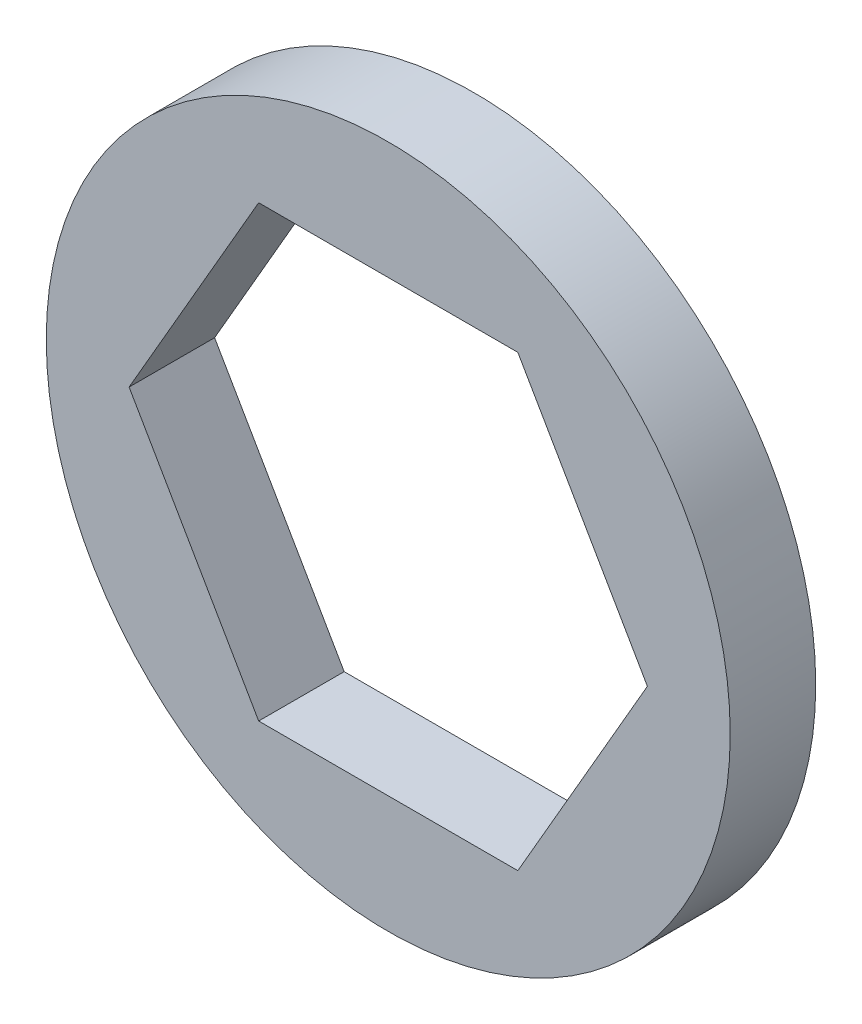
from build123d import *

# Parameters (mm, degrees)
SKETCH1_R           = 4
BOSS_EXTRUDE1_DEPTH = 1


with BuildPart() as part:
    # Sketch1 → Boss-Extrude1 (new body)
    with BuildSketch(Plane.XY):
        Circle(SKETCH1_R)
        Polygon((3.031088913, 0), (1.515544457, 2.625), (-1.515544457, 2.625), (-3.031088913, 0), (-1.515544457, -2.625), (1.515544457, -2.625), align=None, mode=Mode.SUBTRACT)
    extrude(amount=BOSS_EXTRUDE1_DEPTH)


solid = part.part
